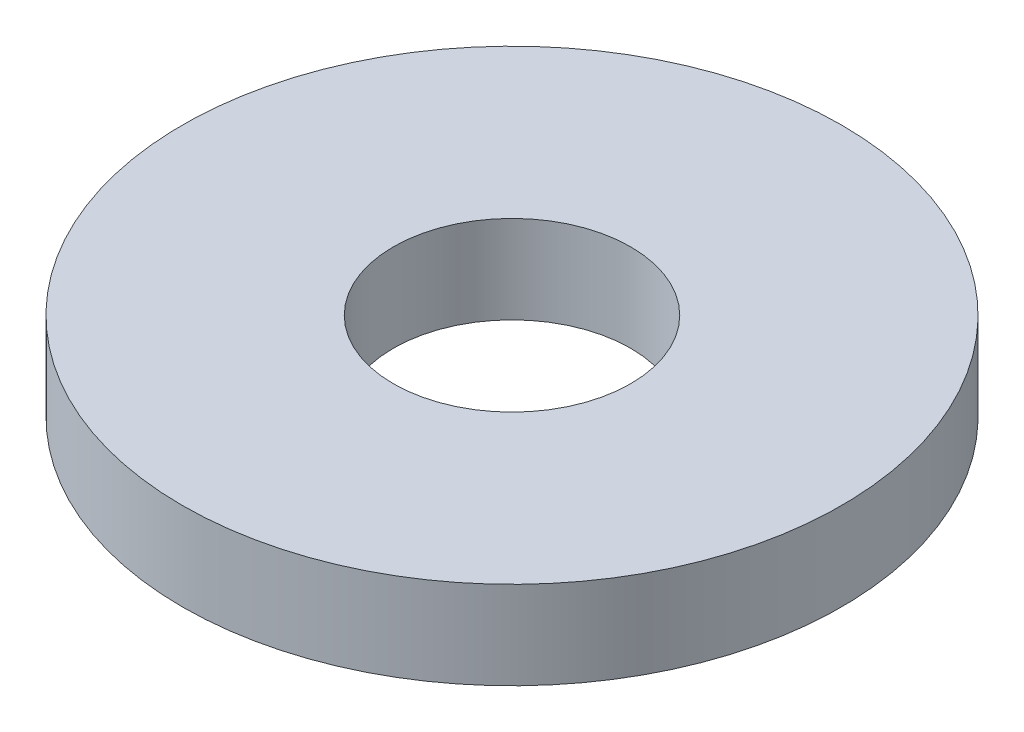
from build123d import *

# Parameters (mm, degrees)
SKETCH1_R           = 7.5
SKETCH1_R_2         = 2.7
BOSS_EXTRUDE1_DEPTH = 2


with BuildPart() as part:
    # Sketch1 → Boss-Extrude1 (new body)
    with BuildSketch(Plane(origin=(0, 0, 0), x_dir=(1, 0, 0), z_dir=(0, 1, 0))):
        with Locations(Location((0, 0, 0), (0, 0, 270))):
            Circle(SKETCH1_R)
        with Locations(Location((0, 0, 0), (0, 0, 270))):
            Circle(SKETCH1_R_2, mode=Mode.SUBTRACT)
    extrude(amount=BOSS_EXTRUDE1_DEPTH)


solid = part.part
